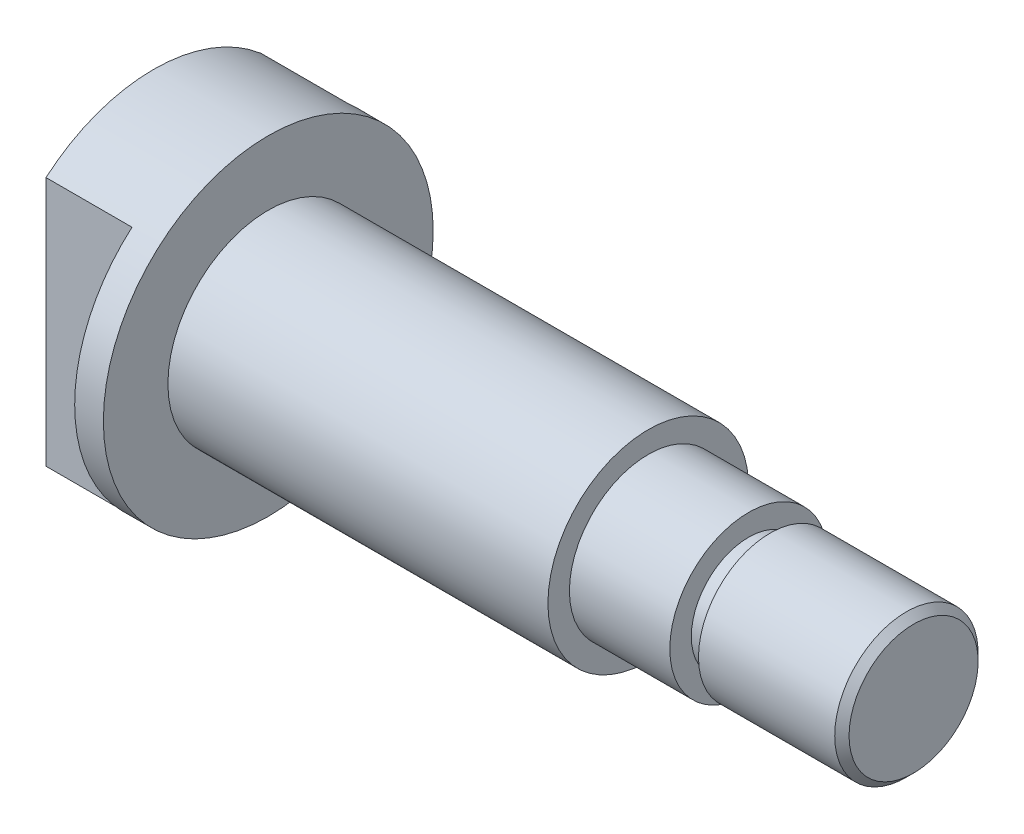
from build123d import *

# Parameters (mm, degrees)
CHAMFER1_SIZE      = 1
CUT_EXTRUDE1_START = -12
CUT_EXTRUDE1_DEPTH = 12


with BuildPart() as part:
    # Sketch1 → Revolve1 (revolve)
    with BuildSketch(Plane.XY):
        Polygon((0, 0), (0, 23), (16, 23), (16, 14), (69, 14), (69, 11), (83, 11), (83, 8), (86, 8), (86, 10), (106, 10), (106, 0), align=None)
    revolve(axis=Axis((0, 0, 0), (1, 0, 0)))

    # Chamfer1
    chamfer1_edges = [part.edges().sort_by_distance(p)[0] for p in [
        (106, -10, 0),
    ]]
    chamfer(chamfer1_edges, length=CHAMFER1_SIZE)

    # Sketch2 → Cut-Extrude1 (cut)
    with BuildSketch(Plane.ZY.offset(CUT_EXTRUDE1_START)):
        with BuildLine():
            Line((-15, 17.435595774), (-15, -17.435595774))
            ThreePointArc((-15, -17.435595774), (-23, 0), (-15, 17.435595774))
        make_face()
        with BuildLine():
            Line((15, 17.435595774), (15, -17.435595774))
            ThreePointArc((15, -17.435595774), (23, 0), (15, 17.435595774))
        make_face()
    extrude(amount=CUT_EXTRUDE1_DEPTH, mode=Mode.SUBTRACT)


solid = part.part
